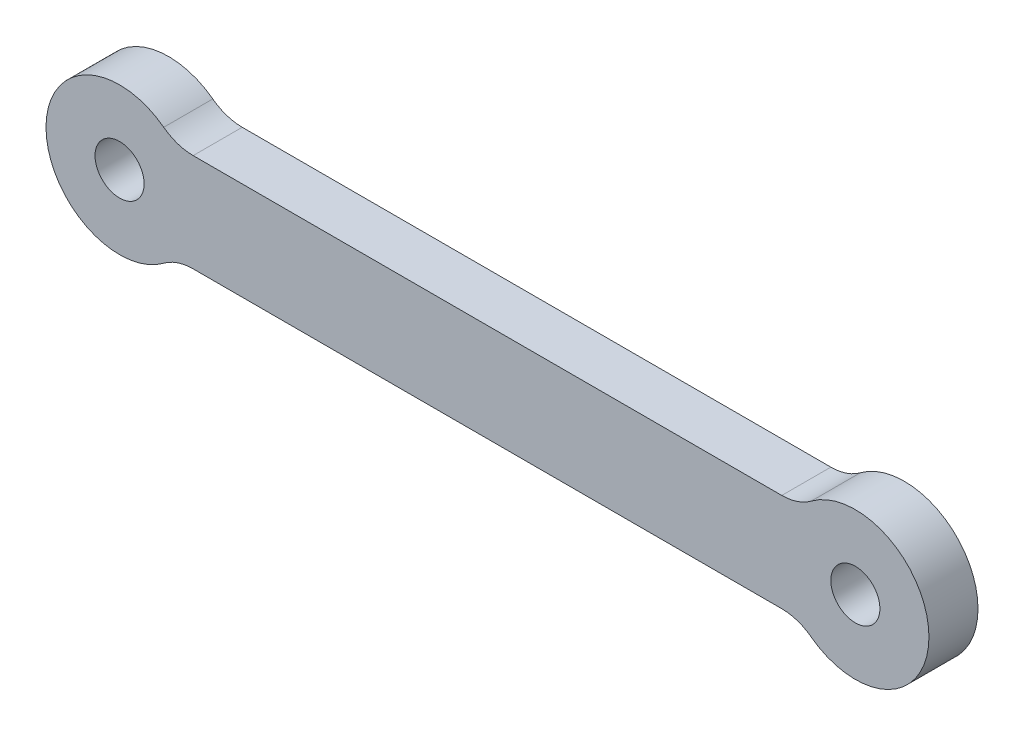
from build123d import *

# Parameters (mm, degrees)
SKETCH1_R           = 1
BOSS_EXTRUDE1_DEPTH = 2


with BuildPart() as part:
    # Sketch1 → Boss-Extrude1 (new body)
    with BuildSketch(Plane.XY):
        with BuildLine():
            Line((0, -2), (0, 2))
            Line((0, 2), (12, 2))
            ThreePointArc((12, 2), (12.632455532, 2.102633404), (13.2, 2.4))
            ThreePointArc((13.2, 2.4), (18, 0), (13.2, -2.4))
            ThreePointArc((13.2, -2.4), (12.632455532, -2.102633404), (12, -2))
            Line((12, -2), (0, -2))
        make_face()
        with Locations((15, 0)):
            Circle(SKETCH1_R, mode=Mode.SUBTRACT)
    boss_extrude1 = extrude(amount=BOSS_EXTRUDE1_DEPTH)

    # Mirror1: Boss-Extrude1 across plane
    add(boss_extrude1.mirror(Plane(origin=(0, -2, 2), x_dir=(0, 0, 1), z_dir=(-1, 0, 0))))


solid = part.part
